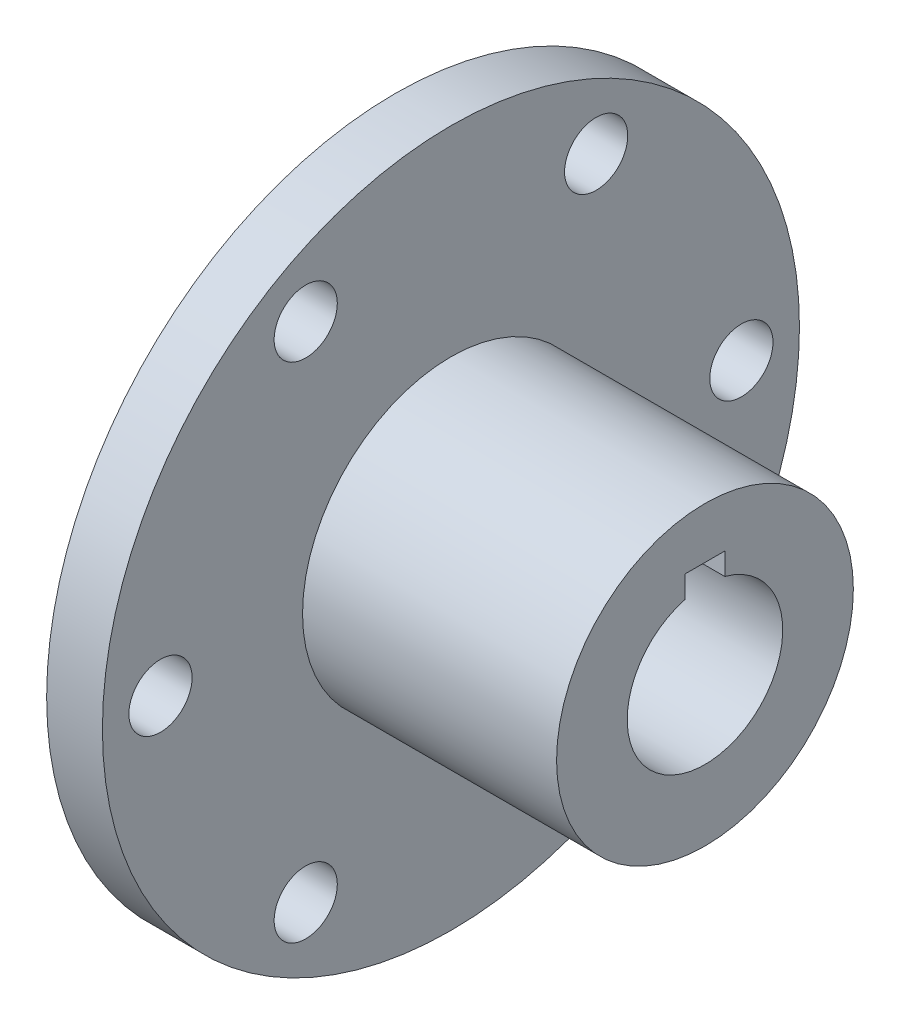
from build123d import *

# Parameters (mm, degrees)
SKETCH1_W      = 4.572
SKETCH1_H      = 28.575
SKETCH2_R      = 12.1666
EXTRUDE1_DEPTH = 20.828
EXTRUDE2_DEPTH = 48.730716001
SKETCH4_W      = 25.4
SKETCH4_H      = 6.3754
HOLE1_D        = 5.1816
HOLE1_DEPTH    = 25.4
HOLE2_D        = 5.1816
HOLE2_DEPTH    = 25.4
HOLE3_D        = 5.1816
HOLE3_DEPTH    = 25.4
HOLE4_D        = 5.1816
HOLE4_DEPTH    = 25.4
HOLE5_D        = 5.1816
HOLE5_DEPTH    = 25.4
HOLE6_D        = 5.1816
HOLE6_DEPTH    = 25.4


with BuildPart() as part:
    # Sketch1 → Revolve1 (revolve)
    with BuildSketch(Plane.XY, mode=Mode.PRIVATE) as revolve1_sk:
        with Locations((-15.321066246, 14.2875)):
            Rectangle(SKETCH1_W, SKETCH1_H)
    revolve(revolve1_sk.sketch.rotate(Axis((-17.607066246, 0, 0), (1, 0, 0)), 270), axis=Axis((-17.607066246, 0, 0), (1, 0, 0)))

    # Sketch2 → Extrude1 (add)
    with BuildSketch(Plane(origin=(-13.035066246, 0, 0), x_dir=(0, 0, -1), z_dir=(1, 0, 0))):
        Circle(SKETCH2_R)
    extrude(amount=EXTRUDE1_DEPTH)

    # Sketch3 → Extrude2 (cut, through all)
    with BuildSketch(Plane.ZY.offset(17.607066246)):
        with BuildLine():
            Line((1.6256, 6.16466948), (1.6256, 7.9756))
            Line((1.6256, 7.9756), (-1.6256, 7.9756))
            Line((-1.6256, 7.9756), (-1.6256, 6.16466948))
            ThreePointArc((-1.6256, 6.16466948), (0, 6.3754), (1.6256, 6.16466948))
        make_face()
    extrude(amount=-EXTRUDE2_DEPTH, mode=Mode.SUBTRACT)

    # Sketch4 → Cut-Revolve1 (revolve, cut)
    with BuildSketch(Plane(origin=(0, 0, 0), x_dir=(-1, 0, 0), z_dir=(0, 0, -1))):
        with Locations((4.907066246, 3.1877)):
            Rectangle(SKETCH4_W, SKETCH4_H)
    revolve(axis=Axis((7.792933754, 0, 0), (-1, 0, 0)), mode=Mode.SUBTRACT)

    # Hole1
    with Locations(Plane.ZY.offset(17.607066246)):
        with Locations((11.90625, -20.622229928)):
            Hole(HOLE1_D / 2, depth=HOLE1_DEPTH)

    # Hole2
    with Locations(Plane.ZY.offset(17.607066246)):
        with Locations((-11.90625, -20.622229928)):
            Hole(HOLE2_D / 2, depth=HOLE2_DEPTH)

    # Hole3
    with Locations(Plane.ZY.offset(17.607066246)):
        with Locations((-23.8125, 0)):
            Hole(HOLE3_D / 2, depth=HOLE3_DEPTH)

    # Hole4
    with Locations(Plane.ZY.offset(17.607066246)):
        with Locations((-11.90625, 20.622229928)):
            Hole(HOLE4_D / 2, depth=HOLE4_DEPTH)

    # Hole5
    with Locations(Plane.ZY.offset(17.607066246)):
        with Locations((11.90625, 20.622229928)):
            Hole(HOLE5_D / 2, depth=HOLE5_DEPTH)

    # Hole6
    with Locations(Plane.ZY.offset(17.607066246)):
        with Locations((23.8125, 0)):
            Hole(HOLE6_D / 2, depth=HOLE6_DEPTH)


solid = part.part
